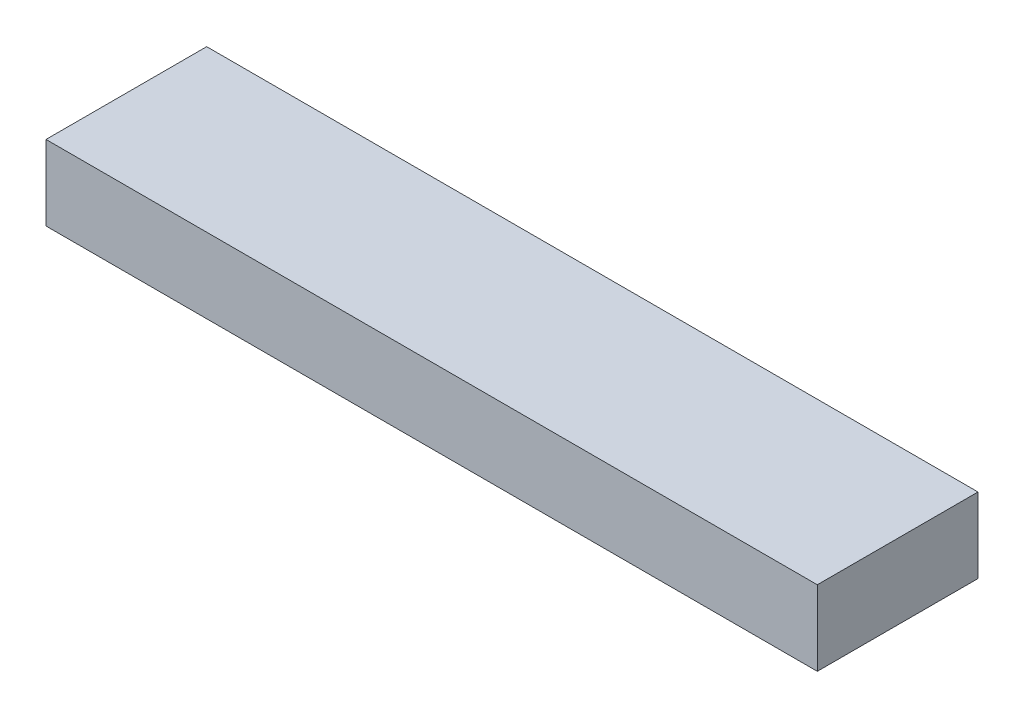
from build123d import *

# Parameters (mm, degrees)
CROQUIS2_W              = 360
CROQUIS2_H              = 75
SALIENTE_EXTRUIR1_DEPTH = 35


with BuildPart() as part:
    # Croquis2 → Saliente-Extruir1 (new body)
    with BuildSketch(Plane(origin=(0, 0, 0), x_dir=(1, 0, 0), z_dir=(0, 1, 0))):
        Rectangle(CROQUIS2_W, CROQUIS2_H)
    extrude(amount=SALIENTE_EXTRUIR1_DEPTH)


solid = part.part
